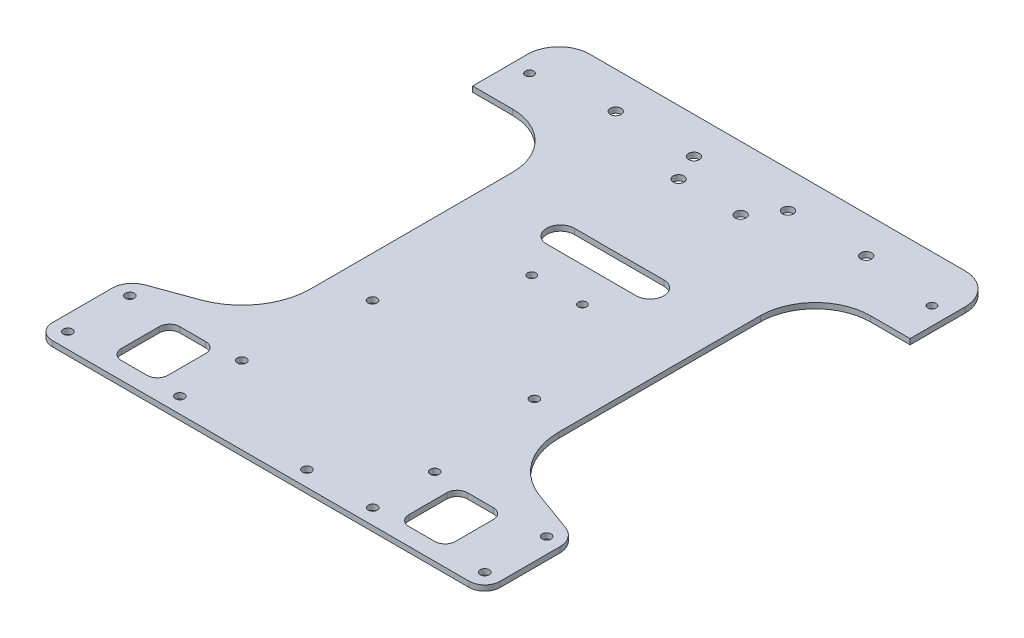
from build123d import *

# Parameters (mm, degrees)
BOSS_EXTRUDE1_DEPTH  = 0.79375
M2_CLEARANCE_HOLE1_D = 2.6
FILLET1_R            = 4.5
M2_CLEARANCE_HOLE3_D = 2.6
FILLET2_R            = 9
M2_CLEARANCE_HOLE2_D = 2.4
FILLET3_R            = 6
FILLET4_R            = 20
FILLET5_R            = 16
CUT_EXTRUDE2_REACH   = 165.486
CUT_EXTRUDE4_DEPTH   = 164.485535006
M2_CLEARANCE_HOLE4_D = 2.4
SKETCH17_R           = 1.575
CUT_EXTRUDE6_DEPTH   = 164.485535006


with BuildPart() as part:
    # Sketch1 → Boss-Extrude1 (new, symmetric)
    with BuildSketch(Plane(origin=(0, 0, 0), x_dir=(1, 0, 0), z_dir=(0, 1, 0))):
        Polygon((-65, -150), (65, -150), (65, -124), (36, -113.444863206), (36, -25), (63.5, -25), (63.5, 0), (-63.5, 0), (-63.5, -25), (-36, -25), (-36, -113.444863206), (-65, -124), align=None)
    extrude(amount=BOSS_EXTRUDE1_DEPTH, both=True)

    # M2 Clearance Hole1 (through all)
    with Locations(Plane(origin=(0, 0.79375, 0), x_dir=(1, 0, 0), z_dir=(0, 1, 0))):
        with Locations((-60.5, -145.5), (60.5, -145.5), (-60.5, -127.5), (60.5, -127.5), (-28, -127.5), (-28, -145.5), (28, -127.5), (28, -145.5)):
            Hole(M2_CLEARANCE_HOLE1_D / 2)

    # Fillet1
    fillet1_edges = [part.edges().sort_by_distance(p)[0] for p in [
        (65, 0, 150),
        (-65, 0, 150),
    ]]
    fillet(fillet1_edges, radius=FILLET1_R)

    # M2 Clearance Hole3 (through all)
    with Locations(Plane(origin=(0, 0.79375, 0), x_dir=(1, 0, 0), z_dir=(0, 1, 0))):
        with Locations((24.13, -94.7), (8.89, -145.5), (-24.13, -93.43)):
            Hole(M2_CLEARANCE_HOLE3_D / 2)

    # Fillet2
    fillet2_edges = [part.edges().sort_by_distance(p)[0] for p in [
        (-63.5, 0, 0),
        (63.5, 0, 0),
    ]]
    fillet(fillet2_edges, radius=FILLET2_R)

    # M2 Clearance Hole2 (through all)
    with Locations(Plane(origin=(0, 0.79375, 0), x_dir=(1, 0, 0), z_dir=(0, 1, 0))):
        with Locations((-58.42, -13.57), (58.42, -13.57)):
            Hole(M2_CLEARANCE_HOLE2_D / 2)

    # Fillet3
    fillet3_edges = [part.edges().sort_by_distance(p)[0] for p in [
        (-65, 0, 124),
        (65, 0, 124),
    ]]
    fillet(fillet3_edges, radius=FILLET3_R)

    # Fillet4
    fillet4_edges = [part.edges().sort_by_distance(p)[0] for p in [
        (-36, 0, 113.444863206),
        (36, 0, 113.444863206),
    ]]
    fillet(fillet4_edges, radius=FILLET4_R)

    # Fillet5
    fillet5_edges = [part.edges().sort_by_distance(p)[0] for p in [
        (-36, 0, 25),
        (36, 0, 25),
    ]]
    fillet(fillet5_edges, radius=FILLET5_R)

    # Sketch9 → Cut-Extrude2 (cut, up to next)
    with BuildSketch(Plane(origin=(0, 0.79375, 0), x_dir=(1, 0, 0), z_dir=(0, 1, 0)), mode=Mode.PRIVATE) as cut_extrude2_sk1:
        with BuildLine():
            Line((-13, -46), (13, -46))
            ThreePointArc((13, -46), (17, -50), (13, -54))
            Line((13, -54), (-13, -54))
            ThreePointArc((-13, -54), (-17, -50), (-13, -46))
        make_face()
    cut_extrude2_tool1 = extrude(cut_extrude2_sk1.sketch, amount=-CUT_EXTRUDE2_REACH, mode=Mode.PRIVATE) & part.part
    add(cut_extrude2_tool1.solids().sort_by_distance((0, 0.79375, 50))[0], mode=Mode.SUBTRACT)

    # Sketch13 → Cut-Extrude4 (cut, through all)
    with BuildSketch(Plane(origin=(0, 0.79375, 0), x_dir=(1, 0, 0), z_dir=(0, 1, 0))):
        with BuildLine():
            Line((-35, -131), (-35, -142))
            ThreePointArc((-35, -142), (-35.878679656, -144.121320344), (-38, -145))
            Line((-38, -145), (-45.5, -145))
            ThreePointArc((-45.5, -145), (-47.621320344, -144.121320344), (-48.5, -142))
            Line((-48.5, -142), (-48.5, -131))
            ThreePointArc((-48.5, -131), (-47.621320344, -128.878679656), (-45.5, -128))
            Line((-45.5, -128), (-38, -128))
            ThreePointArc((-38, -128), (-35.878679656, -128.878679656), (-35, -131))
        make_face()
        with BuildLine():
            Line((35, -131), (35, -142))
            ThreePointArc((35, -142), (35.878679656, -144.121320344), (38, -145))
            Line((38, -145), (45.5, -145))
            ThreePointArc((45.5, -145), (47.621320344, -144.121320344), (48.5, -142))
            Line((48.5, -142), (48.5, -131))
            ThreePointArc((48.5, -131), (47.621320344, -128.878679656), (45.5, -128))
            Line((45.5, -128), (38, -128))
            ThreePointArc((38, -128), (35.878679656, -128.878679656), (35, -131))
        make_face()
    extrude(amount=-CUT_EXTRUDE4_DEPTH, mode=Mode.SUBTRACT)

    # M2 Clearance Hole4 (through all)
    with Locations(Plane(origin=(0, 0.79375, 0), x_dir=(1, 0, 0), z_dir=(0, 1, 0))):
        with Locations((-7.366, -64), (7.366, -64)):
            Hole(M2_CLEARANCE_HOLE4_D / 2)

    # Sketch17 → Cut-Extrude6 (cut, through all)
    with BuildSketch(Plane(origin=(0, 0.79375, 0), x_dir=(1, 0, 0), z_dir=(0, 1, 0))):
        with Locations(Location((7.8, -18.5, 0), (0, 0, 270))):
            Circle(SKETCH17_R)
        with Locations(Location((-10.2, -18.5, 0), (0, 0, 270))):
            Circle(SKETCH17_R)
        with Locations(Location((36.35, -10.6, 0), (0, 0, 270))):
            Circle(SKETCH17_R)
        with Locations(Location((13.65, -10.6, 0), (0, 0, 270))):
            Circle(SKETCH17_R)
        with Locations(Location((-13.65, -10.6, 0), (0, 0, 270))):
            Circle(SKETCH17_R)
        with Locations(Location((-36.35, -10.6, 0), (0, 0, 270))):
            Circle(SKETCH17_R)
    extrude(amount=-CUT_EXTRUDE6_DEPTH, mode=Mode.SUBTRACT)


solid = part.part
